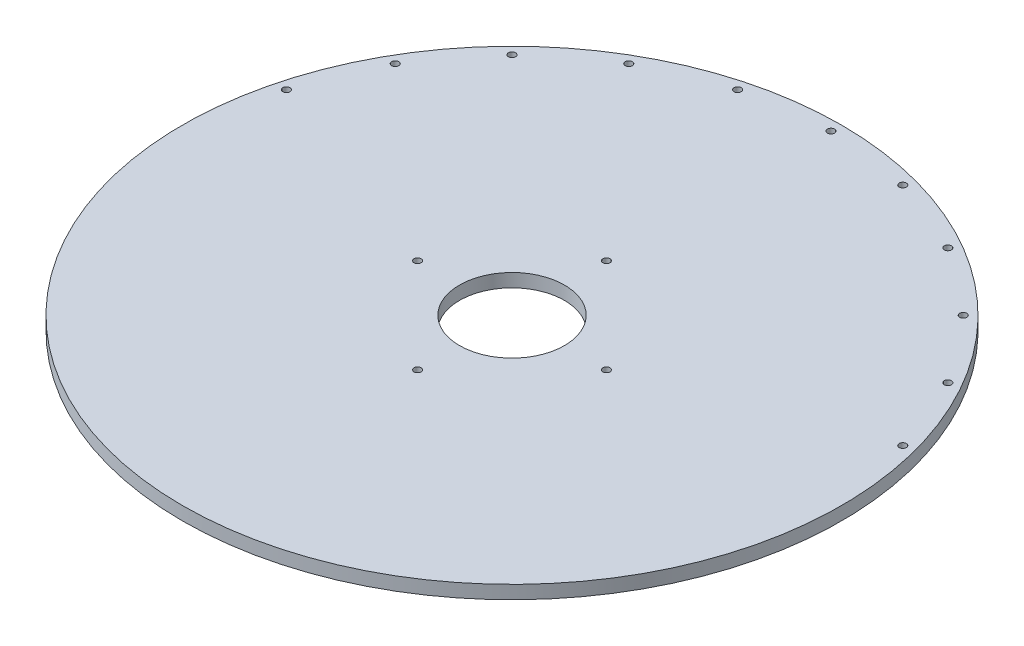
from build123d import *

# Parameters (mm, degrees)
SKETCH2_R           = 157
BOSS_EXTRUDE1_DEPTH = 6.35
SKETCH4_R           = 25
CUT_EXTRUDE1_DEPTH  = 223.122314278
SKETCH5_R           = 1.7
CUT_EXTRUDE2_DEPTH  = 223.122314278
CIRPATTERN1_COUNT   = 4
SKETCH7_R           = 1.7
CUT_EXTRUDE4_DEPTH  = 223.122314278
CIRPATTERN2_COUNT   = 11
CIRPATTERN2_ANGLE   = 150


with BuildPart() as part:
    # Sketch2 → Boss-Extrude1 (new body)
    with BuildSketch(Plane(origin=(0, 0, 0), x_dir=(1, 0, 0), z_dir=(0, 1, 0))):
        with Locations(Location((0, 0, 0), (0, 0, 270))):
            Circle(SKETCH2_R)
    extrude(amount=-BOSS_EXTRUDE1_DEPTH)

    # Sketch4 → Cut-Extrude1 (cut, through all)
    with BuildSketch(Plane(origin=(0, 0, 0), x_dir=(1, 0, 0), z_dir=(0, 1, 0))):
        with Locations(Location((0, 0, 0), (0, 0, 270))):
            Circle(SKETCH4_R)
    extrude(amount=-CUT_EXTRUDE1_DEPTH, mode=Mode.SUBTRACT)

    # Sketch5 → Cut-Extrude2 (cut, through all)
    with BuildSketch(Plane.XZ.offset(6.35)):
        with Locations(Location((0, 45, 0), (0, 0, 270))):
            Circle(SKETCH5_R)
    cut_extrude2 = extrude(amount=-CUT_EXTRUDE2_DEPTH, mode=Mode.SUBTRACT)

    # CirPattern1: Cut-Extrude2 ×4 about axis
    cirpattern1_axis = Axis((0, 0, 0), (0, 1, 0))
    for i in range(1, CIRPATTERN1_COUNT):
        add(cut_extrude2.rotate(cirpattern1_axis, i * 360 / CIRPATTERN1_COUNT), mode=Mode.SUBTRACT)

    # Sketch7 → Cut-Extrude4 (cut, through all)
    with BuildSketch(Plane(origin=(0, 0, 0), x_dir=(1, 0, 0), z_dir=(0, 1, 0))):
        with Locations(Location((-146.820725596, 39.340494856, 0), (0, 0, 270))):
            Circle(SKETCH7_R)
    cut_extrude4 = extrude(amount=-CUT_EXTRUDE4_DEPTH, mode=Mode.SUBTRACT)

    # CirPattern2: Cut-Extrude4 ×11 about axis
    cirpattern2_axis = Axis((0, 0, 0), (0, -1, 0))
    for i in range(1, CIRPATTERN2_COUNT):
        add(cut_extrude4.rotate(cirpattern2_axis, i * CIRPATTERN2_ANGLE / (CIRPATTERN2_COUNT - 1)), mode=Mode.SUBTRACT)


solid = part.part
